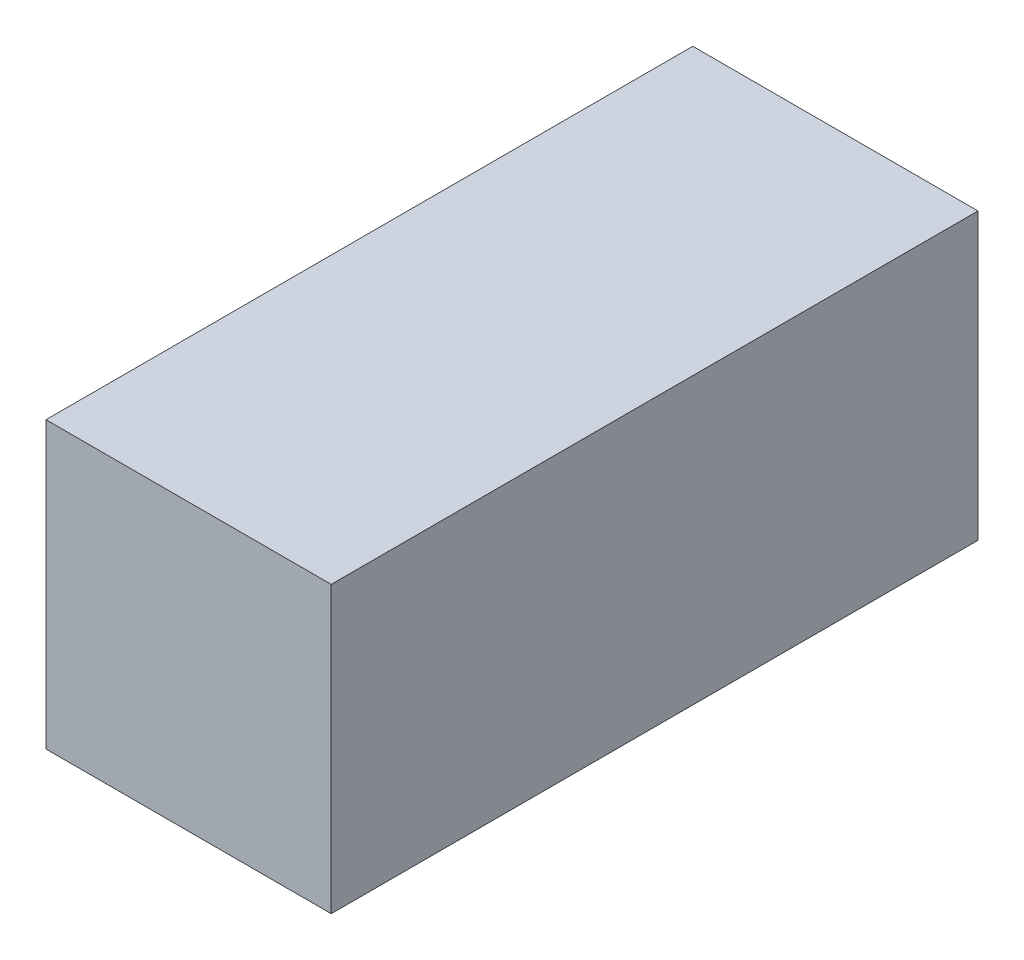
from build123d import *

# Parameters (mm, degrees)
SKETCH1_W           = 2.69
SKETCH1_H           = 6.1
BOSS_EXTRUDE1_DEPTH = 2.69


with BuildPart() as part:
    # Sketch1 → Boss-Extrude1 (new body)
    with BuildSketch(Plane(origin=(0, 0, 0), x_dir=(1, 0, 0), z_dir=(0, 1, 0))):
        with Locations((-1.345, 3.05)):
            Rectangle(SKETCH1_W, SKETCH1_H)
    extrude(amount=BOSS_EXTRUDE1_DEPTH)


solid = part.part
